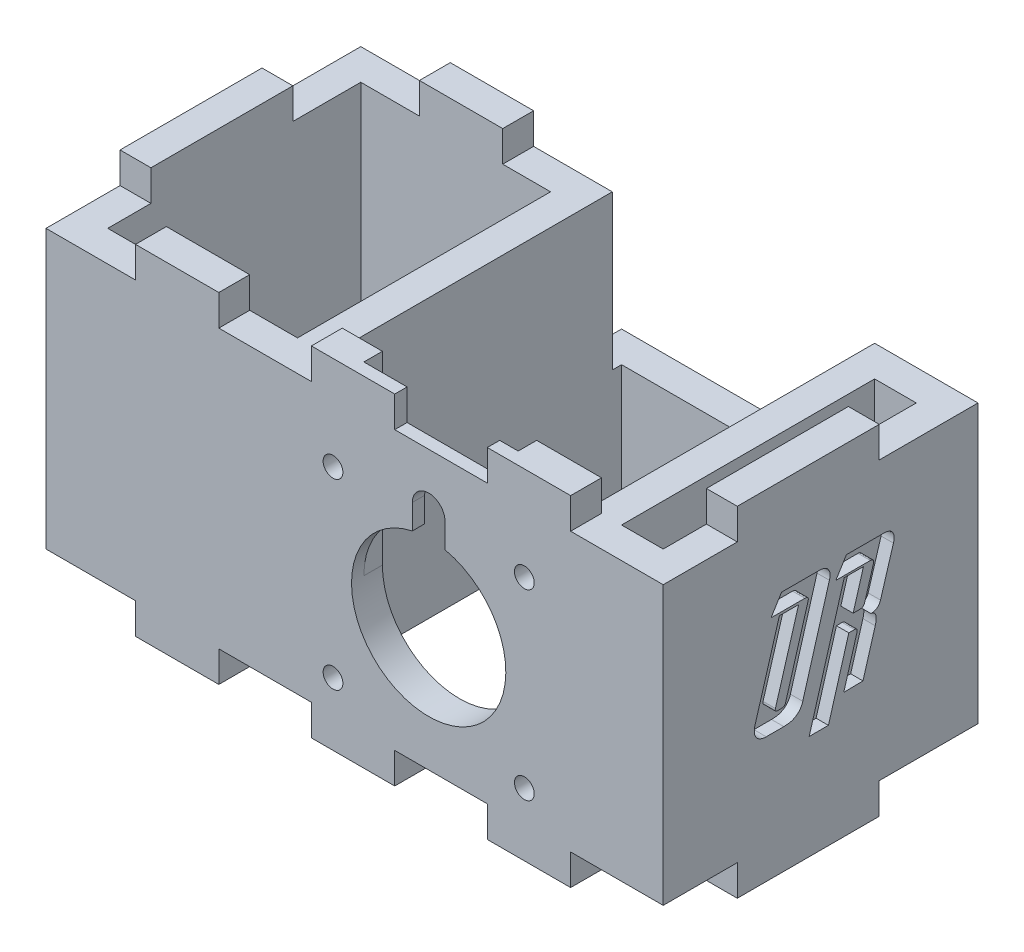
from build123d import *

# Parameters (mm, degrees)
ESQUISSE1_W             = 52.5
ESQUISSE1_H             = 57.5
ESQUISSE1_W_2           = 42.5
ESQUISSE1_H_2           = 47.5
EXTRU_MINCE1_DEPTH      = 20
ESQUISSE3_W             = 6.75
ESQUISSE3_H             = 41
ESQUISSE3_W_2           = 30.75
BOSS_EXTRU_1_DEPTH      = 45
ESQUISSE6_W             = 5
ESQUISSE6_H             = 23
ESQUISSE6_W_2           = 13.5
ESQUISSE6_H_2           = 5
BOSS_EXTRU_3_DEPTH      = 5
ENL_V_MAT_EXTRU_1_REACH = 100.236
ESQUISSE2_R             = 1.6
ENL_V_START             = -3
ENL_V_MAT_EXTRU_2_DEPTH = 3
ENL_V_MAT_EXTRU_3_DEPTH = 2


with BuildPart() as part:
    # Esquisse1 → Extru.-Mince1 (new body)
    with BuildSketch(Plane(origin=(0, 0, 0), x_dir=(1, 0, 0), z_dir=(0, 1, 0))):
        Rectangle(ESQUISSE1_W, ESQUISSE1_H)
        Rectangle(ESQUISSE1_W_2, ESQUISSE1_H_2, mode=Mode.SUBTRACT)
    extrude(amount=EXTRU_MINCE1_DEPTH)

    # Esquisse3 → Boss.-Extru.1 (add)
    with BuildSketch(Plane.XZ):
        Polygon((26.25, 28.75), (38, 28.75), (38, -22.25), (21.25, -22.25), (21.25, 23.75), (-21.25, 23.75), (-21.25, -22.25), (-62, -22.25), (-62, 28.75), (-26.25, 28.75), (0, 28.75), align=None)
        with Locations((29.625, 3.25)):
            Rectangle(ESQUISSE3_W, ESQUISSE3_H, mode=Mode.SUBTRACT)
        with Locations((-41.625, 3.25)):
            Rectangle(ESQUISSE3_W_2, ESQUISSE3_H, mode=Mode.SUBTRACT)
    extrude(amount=-BOSS_EXTRU_1_DEPTH)

    # Esquisse6 → Boss.-Extru.3 (add)
    with BuildSketch(Plane(origin=(0, 45, 0), x_dir=(1, 0, 0), z_dir=(0, 1, 0))):
        with Locations((35.5, -5.25)):
            Rectangle(ESQUISSE6_W, ESQUISSE6_H)
        with Locations((16.25, -26.25)):
            Rectangle(ESQUISSE6_W_2, ESQUISSE6_H_2)
        with Locations((-12.25, -26.25)):
            Rectangle(ESQUISSE6_W_2, ESQUISSE6_H_2)
        with Locations((-40.75, -26.25)):
            Rectangle(ESQUISSE6_W_2, ESQUISSE6_H_2)
        with Locations((-40.75, 19.75)):
            Rectangle(ESQUISSE6_W_2, ESQUISSE6_H_2)
        with Locations((-59.5, -5.25)):
            Rectangle(ESQUISSE6_W, ESQUISSE6_H)
    boss_extru_3 = extrude(amount=BOSS_EXTRU_3_DEPTH)

    # Esquisse2 → Enlèv. mat.-Extru.1 (cut, up to next)
    with BuildSketch(Plane.XY.offset(28.75), mode=Mode.PRIVATE) as enl_v_mat_extru_1_sk1:
        with Locations((-15.5, 5.2)):
            Circle(ESQUISSE2_R)
    enl_v_mat_extru_1_tool1 = extrude(enl_v_mat_extru_1_sk1.sketch, amount=-ENL_V_MAT_EXTRU_1_REACH, mode=Mode.PRIVATE) & part.part
    # Esquisse2 → Enlèv. mat.-Extru.1 (cut, up to next)
    with BuildSketch(Plane.XY.offset(28.75), mode=Mode.PRIVATE) as enl_v_mat_extru_1_sk2:
        with Locations((15.5, 5.2)):
            Circle(ESQUISSE2_R)
    enl_v_mat_extru_1_tool2 = extrude(enl_v_mat_extru_1_sk2.sketch, amount=-ENL_V_MAT_EXTRU_1_REACH, mode=Mode.PRIVATE) & part.part
    # Esquisse2 → Enlèv. mat.-Extru.1 (cut, up to next)
    with BuildSketch(Plane.XY.offset(28.75), mode=Mode.PRIVATE) as enl_v_mat_extru_1_sk3:
        with Locations(Location((15.5, 34.8, 0), (0, 0, 180))):
            Circle(ESQUISSE2_R)
    enl_v_mat_extru_1_tool3 = extrude(enl_v_mat_extru_1_sk3.sketch, amount=-ENL_V_MAT_EXTRU_1_REACH, mode=Mode.PRIVATE) & part.part
    # Esquisse2 → Enlèv. mat.-Extru.1 (cut, up to next)
    with BuildSketch(Plane.XY.offset(28.75), mode=Mode.PRIVATE) as enl_v_mat_extru_1_sk4:
        with Locations(Location((-15.5, 34.8, 0), (0, 0, 180))):
            Circle(ESQUISSE2_R)
    enl_v_mat_extru_1_tool4 = extrude(enl_v_mat_extru_1_sk4.sketch, amount=-ENL_V_MAT_EXTRU_1_REACH, mode=Mode.PRIVATE) & part.part
    # Esquisse2 → Enlèv. mat.-Extru.1 (cut, up to next)
    with BuildSketch(Plane.XY.offset(28.75), mode=Mode.PRIVATE) as enl_v_mat_extru_1_sk5:
        with BuildLine():
            Line((2.65, 36.215870824), (2.65, 32.215870824))
            ThreePointArc((2.65, 32.215870824), (0, 7.5), (-2.65, 32.215870824))
            Line((-2.65, 32.215870824), (-2.65, 36.215870824))
            ThreePointArc((-2.65, 36.215870824), (0, 38.865870824), (2.65, 36.215870824))
        make_face()
    enl_v_mat_extru_1_tool5 = extrude(enl_v_mat_extru_1_sk5.sketch, amount=-ENL_V_MAT_EXTRU_1_REACH, mode=Mode.PRIVATE) & part.part
    add(enl_v_mat_extru_1_tool1.solids().sort_by_distance((-15.5, 5.2, 28.75))[0], mode=Mode.SUBTRACT)
    add(enl_v_mat_extru_1_tool2.solids().sort_by_distance((15.5, 5.2, 28.75))[0], mode=Mode.SUBTRACT)
    add(enl_v_mat_extru_1_tool3.solids().sort_by_distance((15.5, 34.8, 28.75))[0], mode=Mode.SUBTRACT)
    add(enl_v_mat_extru_1_tool4.solids().sort_by_distance((-15.5, 34.8, 28.75))[0], mode=Mode.SUBTRACT)
    add(enl_v_mat_extru_1_tool5.solids().sort_by_distance((0, 20.91985, 28.75))[0], mode=Mode.SUBTRACT)

    # Esquisse4 → Enlèv. mat.-Extru.2 (cut)
    with BuildSketch(Plane(origin=(0, 0, 23.75), x_dir=(-1, 0, 0), z_dir=(0, 0, -1)).offset(ENL_V_START)):
        with BuildLine():
            Line((-12.5, 20), (-12.5, 50))
            Line((-12.5, 50), (12.5, 50))
            Line((12.5, 50), (12.5, 20))
            ThreePointArc((12.5, 20), (0, 32.5), (-12.5, 20))
        make_face()
    extrude(amount=ENL_V_MAT_EXTRU_2_DEPTH, mode=Mode.SUBTRACT)

    # Symétrie1: Boss.-Extru.3 across plane
    add(boss_extru_3.mirror(Plane(origin=(0, 22.5, 0), x_dir=(0, 0, 1), z_dir=(0, -1, 0))))

    # Esquisse9 → Enlèv. mat.-Extru.3 (cut)
    with BuildSketch(Plane(origin=(38, 0, 0), x_dir=(0, 0, -1), z_dir=(1, 0, 0))):
        with BuildLine():
            add(Edge.make_bspline(
                [(-5.276399436, 30.978102412), (-5.263874778, 31.027852004), (-5.240625388, 31.120201649), (-5.234134999, 31.253254709), (-5.253019349, 31.368501739), (-5.30745843, 31.463411083), (-5.392131196, 31.533482386), (-5.501193145, 31.586192261), (-5.638953386, 31.613300642), (-5.739322503, 31.616992632), (-5.793945888, 31.619001905)],
                knots=[0, 0, 0, 0, 1.200744757, 2.228929884, 3.104743097, 3.903101275, 4.735424252, 5.644967986, 6.718332635, 8, 8, 8, 8], degree=3))
            Line((-5.793945888, 31.619001905), (-11.280474605, 31.619001905))
            Line((-11.280474605, 31.619001905), (-9.57498474, 34.364947851))
            Line((-9.57498474, 34.364947851), (-3.477053996, 34.364947851))
            add(Edge.make_bspline(
                [(-3.477053996, 34.364947851), (-3.392041951, 34.362844113), (-3.227739325, 34.358778224), (-2.991664009, 34.329047198), (-2.774432756, 34.282027765), (-2.577485345, 34.211722439), (-2.399008538, 34.122933531), (-2.238312716, 34.015966922), (-2.100499352, 33.884936272), (-1.983271405, 33.736747615), (-1.882837523, 33.576632699), (-1.808066388, 33.402626829), (-1.753156945, 33.219225315), (-1.725050388, 33.025131969), (-1.716911769, 32.821985435), (-1.731556669, 32.609259178), (-1.765175413, 32.386112471), (-1.806596617, 32.237192737), (-1.827877476, 32.160682648)],
                knots=[0, 0, 0, 0, 1.227025702, 2.371470339, 3.429649678, 4.429654124, 5.381889622, 6.301745996, 7.205530584, 8.114459748, 9.024121477, 9.9255999, 10.840282126, 11.780196128, 12.748817052, 13.770322343, 14.854464549, 16, 16, 16, 16], degree=3))
            Line((-1.827877476, 32.160682648), (-6.145233895, 17.334183493))
            add(Edge.make_bspline(
                [(-6.145233895, 17.334183493), (-6.174680933, 17.238777523), (-6.231769773, 17.053814403), (-6.34566533, 16.793925059), (-6.478910471, 16.559510265), (-6.634262023, 16.352654727), (-6.800152242, 16.165636627), (-6.982169525, 16.003471772), (-7.168623311, 15.853633702), (-7.434481602, 15.686394748), (-7.79240231, 15.522293141), (-8.250009091, 15.395022272), (-8.724848658, 15.331006046), (-9.044760169, 15.320305259), (-9.204925618, 15.314947851)],
                knots=[0, 0, 0, 0, 0.904305839, 1.753173633, 2.56606415, 3.342155626, 4.093630258, 4.827654605, 5.54882605, 6.258993598, 7.668964108, 9.099978565, 10.548088398, 12, 12, 12, 12], degree=3))
            Line((-9.204925618, 15.314947851), (-12.058135078, 15.314947851))
            add(Edge.make_bspline(
                [(-12.058135078, 15.314947851), (-12.140499871, 15.316807231), (-12.301416323, 15.320439911), (-12.537170796, 15.354868613), (-12.762999138, 15.404415207), (-12.977332584, 15.476409355), (-13.175848365, 15.569326421), (-13.354874033, 15.684319858), (-13.517867017, 15.814800421), (-13.65743983, 15.969575454), (-13.777473744, 16.142577986), (-13.871223779, 16.336256333), (-13.937507955, 16.549834806), (-13.984780678, 16.781415757), (-13.998942718, 17.034743792), (-13.984941002, 17.307979584), (-13.938646033, 17.601770035), (-13.885322765, 17.801220497), (-13.857480517, 17.905361702)],
                knots=[0, 0, 0, 0, 1.038589481, 2.029096732, 3.000411816, 3.952682251, 4.875924781, 5.758235803, 6.631926692, 7.502116385, 8.378061026, 9.280964095, 10.204757568, 11.193465298, 12.255788728, 13.396298177, 14.640501287, 16, 16, 16, 16], degree=3))
            Line((-13.857480517, 17.905361702), (-9.926272746, 31.235534844))
            Line((-9.926272746, 31.235534844), (-6.812949267, 31.235534844))
            Line((-6.812949267, 31.235534844), (-10.575217003, 18.54089802))
            add(Edge.make_bspline(
                [(-10.575217003, 18.54089802), (-10.585371689, 18.503585367), (-10.604023046, 18.435052316), (-10.61286767, 18.336266486), (-10.604862505, 18.250382179), (-10.570319939, 18.179561324), (-10.517057955, 18.122517913), (-10.440962113, 18.085716453), (-10.347477123, 18.065268453), (-10.279468579, 18.062428956), (-10.242700111, 18.060893797)],
                knots=[0, 0, 0, 0, 1.268310745, 2.32953697, 3.247763845, 4.062404139, 4.872795954, 5.766252807, 6.79233614, 8, 8, 8, 8], degree=3))
            Line((-10.242700111, 18.060893797), (-9.483810753, 18.060893797))
            add(Edge.make_bspline(
                [(-9.483810753, 18.060893797), (-9.446181323, 18.062553667), (-9.37472233, 18.065705792), (-9.274210415, 18.085954678), (-9.189052318, 18.123746459), (-9.092660902, 18.197707845), (-8.997480813, 18.33757604), (-8.951345062, 18.467148443), (-8.926040483, 18.538216432)],
                knots=[0, 0, 0, 0, 0.844699856, 1.604100825, 2.286462665, 2.916384278, 4.308695666, 6, 6, 6, 6], degree=3))
            Line((-8.926040483, 18.538216432), (-5.276399436, 30.978102412))
        make_face()
        with BuildLine():
            add(Edge.make_bspline(
                [(3.132523706, 25.612245148), (3.215634146, 25.619179629), (3.378399267, 25.632760252), (3.571514548, 25.718122224), (3.703245186, 25.834231561), (3.788659226, 25.964183234), (3.870534224, 26.126506206), (3.910236848, 26.250609874), (3.931636882, 26.31750275)],
                knots=[0, 0, 0, 0, 1.287265703, 2.521006488, 3.188322154, 3.983954908, 4.91333547, 6, 6, 6, 6], degree=3))
            Line((3.931636882, 26.31750275), (5.301928267, 30.894973189))
            add(Edge.make_bspline(
                [(5.301928267, 30.894973189), (5.316357635, 30.950916879), (5.343102376, 31.054608153), (5.352899538, 31.204955548), (5.332846143, 31.334059308), (5.284019314, 31.441564746), (5.203019076, 31.52523239), (5.091379464, 31.579574907), (4.954577128, 31.61502946), (4.854370835, 31.617612517), (4.800471341, 31.619001905)],
                knots=[0, 0, 0, 0, 1.269702279, 2.353385088, 3.291366245, 4.118613865, 4.911701318, 5.800525574, 6.816934998, 8, 8, 8, 8], degree=3))
            Line((4.800471341, 31.619001905), (-0.777231361, 31.619001905))
            Line((-0.777231361, 31.619001905), (0.928258504, 34.364947851))
            Line((0.928258504, 34.364947851), (6.988647017, 34.364947851))
            add(Edge.make_bspline(
                [(6.988647017, 34.364947851), (7.07365656, 34.362899504), (7.236180383, 34.358983413), (7.469676062, 34.329113123), (7.682574236, 34.281008676), (7.876894588, 34.216258196), (8.048230947, 34.125379045), (8.199907707, 34.018311161), (8.33134779, 33.890569748), (8.437582187, 33.742261819), (8.523166214, 33.580082633), (8.590741677, 33.408486979), (8.636669357, 33.226514683), (8.660651412, 33.034720184), (8.662007607, 32.833439464), (8.645970372, 32.62250896), (8.608557899, 32.40245305), (8.567653623, 32.255112269), (8.546649551, 32.179453763)],
                knots=[0, 0, 0, 0, 1.251338017, 2.392345991, 3.458656697, 4.461694018, 5.397650846, 6.303325578, 7.187420856, 8.082419285, 8.977320952, 9.881560306, 10.791242046, 11.733101695, 12.720213325, 13.749750695, 14.844512033, 16, 16, 16, 16], degree=3))
            Line((8.546649551, 32.179453763), (6.452329449, 25.236822851))
            add(Edge.make_bspline(
                [(6.452329449, 25.236822851), (6.42712875, 25.167327882), (6.376688633, 25.028231175), (6.27026054, 24.828524262), (6.132151238, 24.643422474), (5.972746127, 24.464785453), (5.77084358, 24.311476928), (5.516616366, 24.20994716), (5.220308525, 24.14460646), (5.007357164, 24.138128578), (4.894326916, 24.13469025)],
                knots=[0, 0, 0, 0, 0.858061207, 1.717440721, 2.616729748, 3.535235509, 4.492594278, 5.530155533, 6.689056816, 8, 8, 8, 8], degree=3))
            add(Edge.make_bspline(
                [(4.894326916, 24.13469025), (4.947344087, 24.129144721), (5.049408685, 24.118468893), (5.192812259, 24.077133164), (5.320314257, 24.020780097), (5.43322798, 23.948819219), (5.52477109, 23.854021558), (5.604187548, 23.747015798), (5.663435703, 23.620048083), (5.71952912, 23.426827151), (5.754731882, 23.159154741), (5.755018267, 22.815406924), (5.700798774, 22.444754825), (5.634389278, 22.193502481), (5.599584517, 22.061822851)],
                knots=[0, 0, 0, 0, 0.748232156, 1.440439236, 2.087360142, 2.704291393, 3.308549052, 3.929435439, 4.570224255, 5.265958673, 6.751725874, 8.347722503, 10.085866424, 12, 12, 12, 12], degree=3))
            Line((5.599584517, 22.061822851), (3.615209517, 15.314947851))
            Line((3.615209517, 15.314947851), (0.501886037, 15.261316094))
            Line((0.501886037, 15.261316094), (2.652519483, 22.643727412))
            add(Edge.make_bspline(
                [(2.652519483, 22.643727412), (2.662873368, 22.685484987), (2.68207212, 22.762914217), (2.688557241, 22.875751875), (2.673299823, 22.975288018), (2.635188992, 23.060998219), (2.574436282, 23.132544153), (2.484069685, 23.177640263), (2.37290524, 23.207574951), (2.289865706, 23.208851484), (2.244918132, 23.209542445)],
                knots=[0, 0, 0, 0, 1.198272128, 2.22190316, 3.132016759, 3.980240005, 4.810681926, 5.692336566, 6.750909741, 8, 8, 8, 8], degree=3))
            Line((2.244918132, 23.209542445), (1.31708874, 23.209542445))
            Line((1.31708874, 23.209542445), (-1.981264301, 11.882515418))
            Line((-1.981264301, 11.882515418), (-5.097269368, 11.882515418))
            Line((-5.097269368, 11.882515418), (0.576970497, 31.321345655))
            Line((0.576970497, 31.321345655), (3.690293976, 31.321345655))
            Line((3.690293976, 31.321345655), (2.022346341, 25.612245148))
            Line((2.022346341, 25.612245148), (3.132523706, 25.612245148))
        make_face()
    extrude(amount=-ENL_V_MAT_EXTRU_3_DEPTH, mode=Mode.SUBTRACT)


solid = part.part
